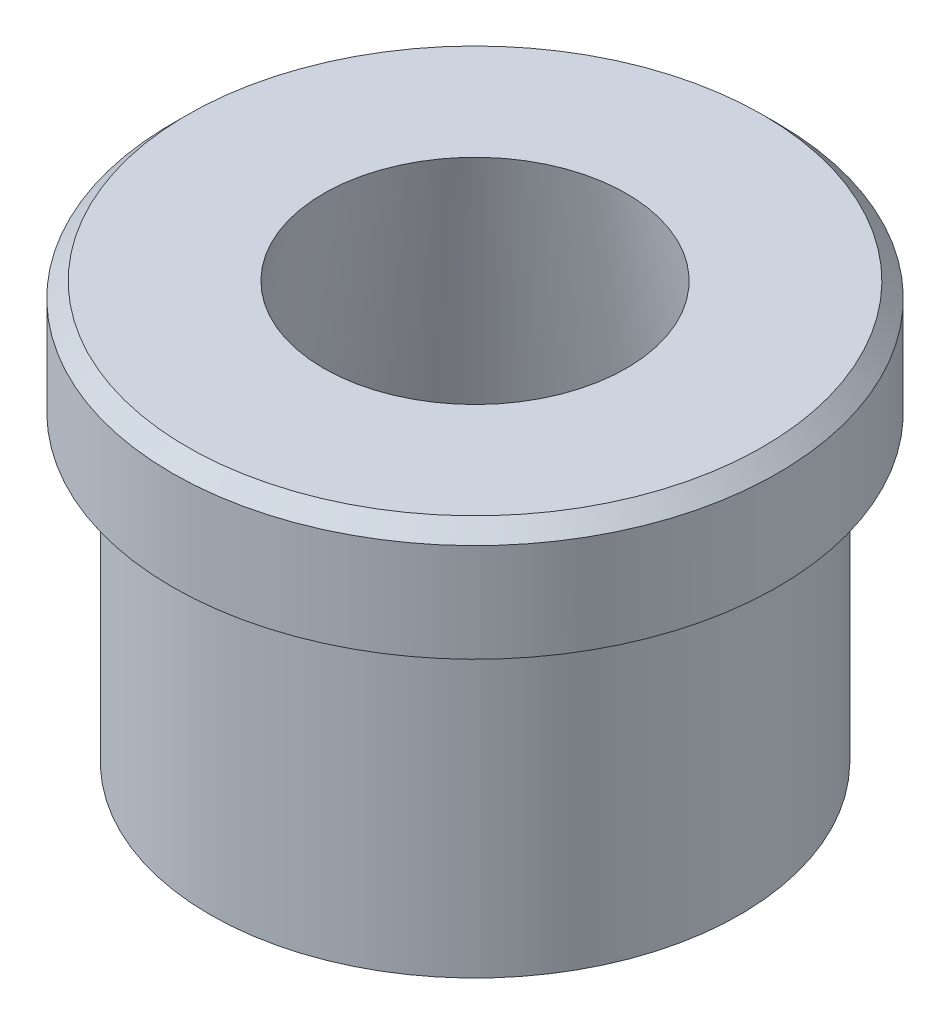
from build123d import *
from OCP.BRepFilletAPI import BRepFilletAPI_MakeChamfer

# Parameters (mm, degrees)
CHAMFER1_SIZE  = 0.2
CHAMFER1_SIZE2 = 0.248451997


with BuildPart() as part:
    # Sketch1 → Revolve1 (revolve)
    with BuildSketch(Plane.XY, mode=Mode.PRIVATE) as revolve1_sk:
        Polygon((-3, 0), (-3.5, 0), (-3.5, 4), (-4, 4), (-4, 5.5), (-2, 5.5), align=None)
    revolve(revolve1_sk.sketch.rotate(Axis((0, 5.5, 0), (0, -1, 0)), 270), axis=Axis((0, 5.5, 0), (0, -1, 0)))

    # Chamfer1: one chamfer whose edges measure the first distance from different faces: ONE call of the kernel's chamfer builder (chamfer() names one face for all edges)
    chamfer1_edges_1 = [part.edges().sort_by_distance(p)[0] for p in [
        (0, 5.5, -4),
    ]]
    chamfer1_edges_2 = [part.edges().sort_by_distance(p)[0] for p in [
        (0, 0, -3),
    ]]
    chamfer1_side_2 = [part.faces().sort_by_distance(p)[0] for p in [
        (0, 2.75, -2.5),
    ]]
    chamfer1 = BRepFilletAPI_MakeChamfer(part.part.solid().wrapped)
    for e in chamfer1_edges_1:
        chamfer1.Add(CHAMFER1_SIZE, e.wrapped)
    for e in chamfer1_edges_2:
        chamfer1.Add(CHAMFER1_SIZE, CHAMFER1_SIZE2, e.wrapped, chamfer1_side_2[0].wrapped)  # the first distance lies on this face
    add(Compound.cast(chamfer1.Shape()), mode=Mode.REPLACE)


solid = part.part
